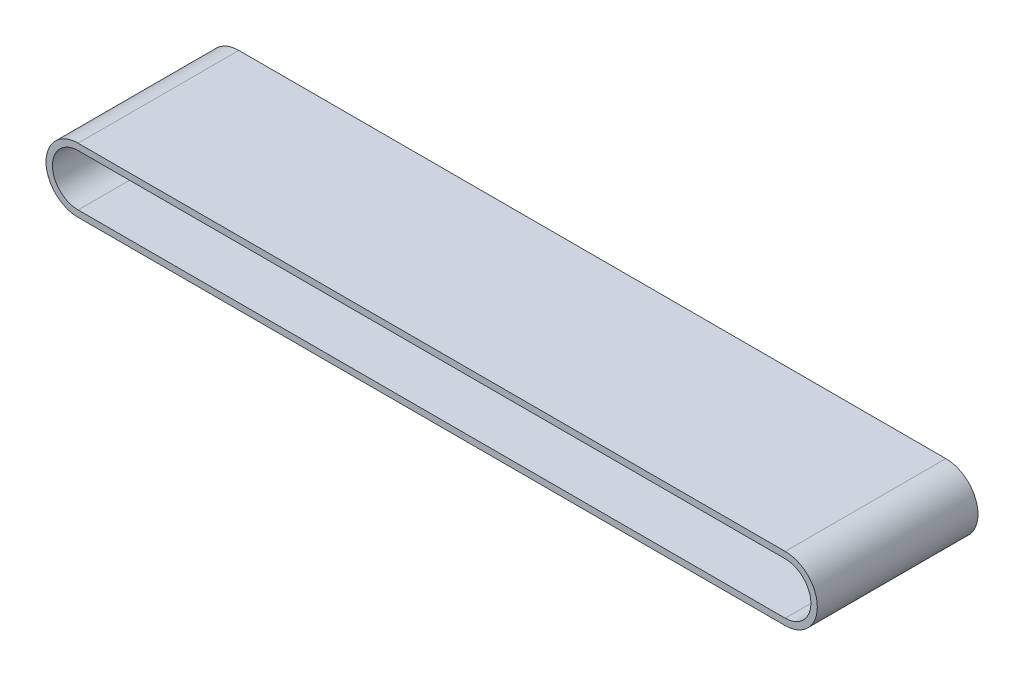
from build123d import *

# Parameters (mm, degrees)
SKETCH2_R           = 50
SKETCH2_W           = 1100
SKETCH2_H           = 100
BOSS_EXTRUDE1_DEPTH = 250
SKETCH3_R           = 40
SKETCH3_W           = 1100
SKETCH3_H           = 80
CUT_EXTRUDE1_DEPTH  = 1182.101181102


with BuildPart() as part:
    # Sketch2 → Boss-Extrude1 (new body)
    with BuildSketch(Plane.XY):
        with Locations((-1100, 50)):
            Circle(SKETCH2_R)
        with Locations((0, 50)):
            Circle(SKETCH2_R)
        with Locations((-550, 50)):
            Rectangle(SKETCH2_W, SKETCH2_H)
    extrude(amount=BOSS_EXTRUDE1_DEPTH)

    # Sketch3 → Cut-Extrude1 (cut, through all)
    with BuildSketch(Plane.XY.offset(250)):
        with Locations((-1100, 50)):
            Circle(SKETCH3_R)
        with Locations((0, 50)):
            Circle(SKETCH3_R)
        with Locations((-550, 50)):
            Rectangle(SKETCH3_W, SKETCH3_H)
    extrude(amount=-CUT_EXTRUDE1_DEPTH, mode=Mode.SUBTRACT)


solid = part.part
